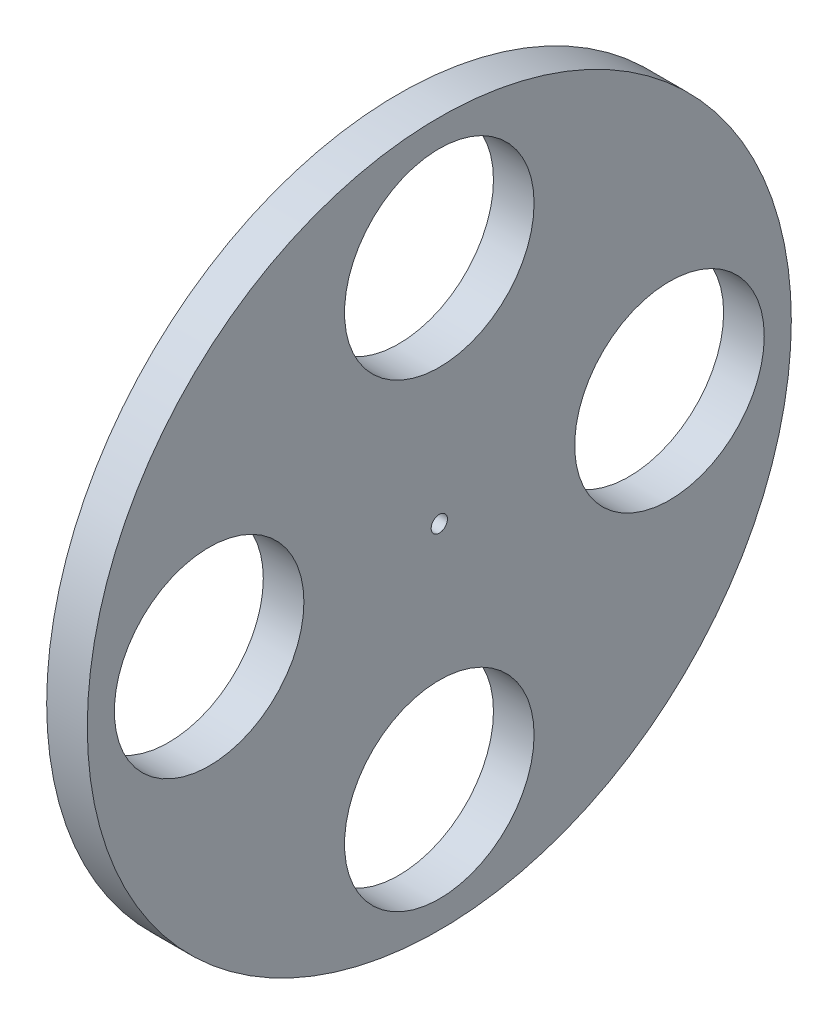
from build123d import *

# Parameters (mm, degrees)
ESQUISSE2_R             = 130
BOSS_EXTRU_1_DEPTH      = 15
ESQUISSE3_R             = 35
ENL_V_MAT_EXTRU_1_DEPTH = 15
ESQUISSE4_R             = 3
ENL_V_MAT_EXTRU_3_DEPTH = 24


with BuildPart() as part:
    # Esquisse2 → Boss.-Extru.1 (new body)
    with BuildSketch(Plane(origin=(0, 0, 0), x_dir=(0, 0, -1), z_dir=(1, 0, 0))):
        Circle(ESQUISSE2_R)
    extrude(amount=BOSS_EXTRU_1_DEPTH)

    # Esquisse3 → Enlèv. mat.-Extru.1 (cut)
    with BuildSketch(Plane(origin=(15, 0, 0), x_dir=(0, 0, -1), z_dir=(1, 0, 0))):
        with Locations((0, 85)):
            Circle(ESQUISSE3_R)
        with Locations((85, 0)):
            Circle(ESQUISSE3_R)
        with Locations((0, -85)):
            Circle(ESQUISSE3_R)
        with Locations((-85, 0)):
            Circle(ESQUISSE3_R)
    extrude(amount=-ENL_V_MAT_EXTRU_1_DEPTH, mode=Mode.SUBTRACT)

    # Esquisse4 → Enlèv. mat.-Extru.3 (cut)
    with BuildSketch(Plane(origin=(15, 0, 0), x_dir=(0, 0, -1), z_dir=(1, 0, 0))):
        Circle(ESQUISSE4_R)
    extrude(amount=-ENL_V_MAT_EXTRU_3_DEPTH, mode=Mode.SUBTRACT)


solid = part.part
